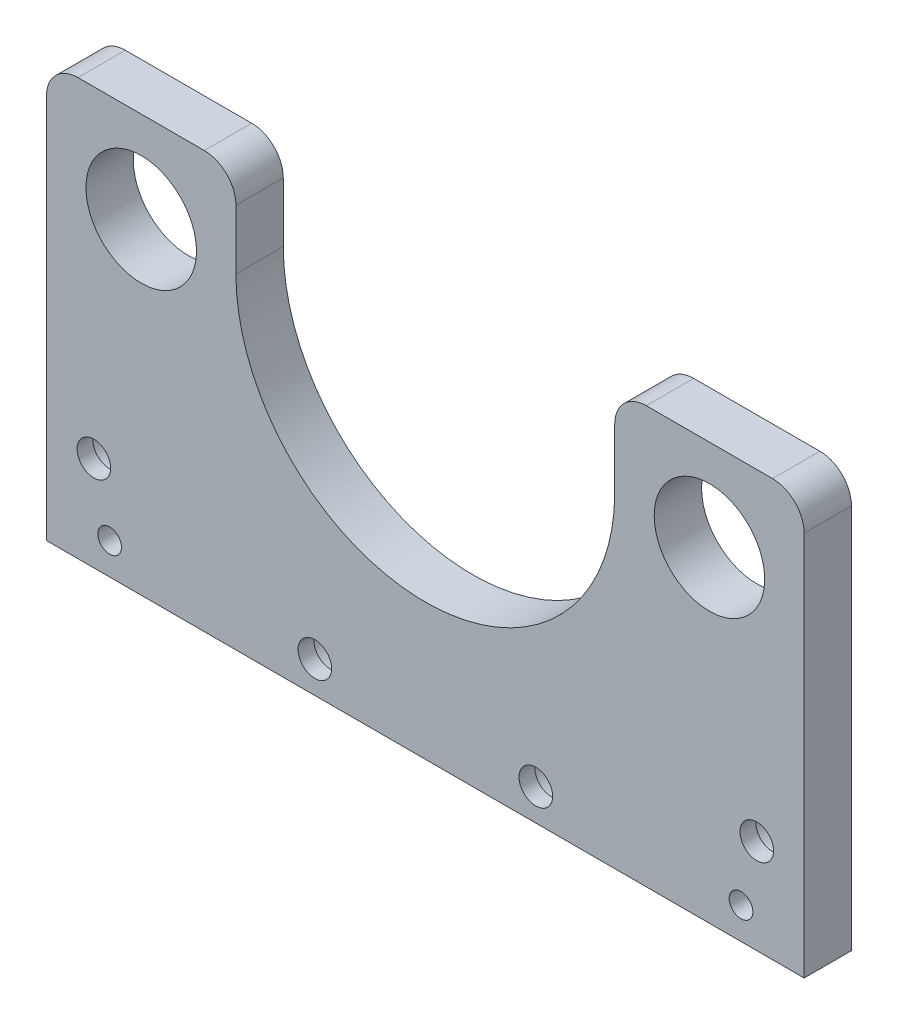
from build123d import *

# Parameters (mm, degrees)
SKETCH1_R                                   = 11.1125
BASE_DEPTH                                  = 4.7625
F_1_4_CAP_SCREW_CARRIAGE_MOUNTS_D           = 6.7564
F_1_4_CAP_SCREW_CARRIAGE_MOUNTS_CBORE_D     = 11.1125
F_1_4_CAP_SCREW_CARRIAGE_MOUNTS_CBORE_DEPTH = 6.35
SKETCH9_R                                   = 2.38125
ALIGNMENT_PIN_HOLES_DEPTH                   = 6.35


with BuildPart() as part:
    # Sketch1 → Base (new, symmetric)
    with BuildSketch(Plane.XY):
        with BuildLine():
            Line((76.2, 11.98626), (76.2, -65.48374))
            Line((76.2, -65.48374), (-76.2, -65.48374))
            Line((-76.2, -65.48374), (-76.2, 11.98626))
            ThreePointArc((-76.2, 11.98626), (-74.340128061, 16.476388061), (-69.85, 18.33626))
            Line((-69.85, 18.33626), (-44.45, 18.33626))
            ThreePointArc((-44.45, 18.33626), (-39.959871939, 16.476388061), (-38.1, 11.98626))
            Line((-38.1, 11.98626), (-38.1, 0))
            ThreePointArc((-38.1, 0), (0, -38.1), (38.1, 0))
            Line((38.1, 0), (38.1, 11.98626))
            ThreePointArc((38.1, 11.98626), (39.959871939, 16.476388061), (44.45, 18.33626))
            Line((44.45, 18.33626), (69.85, 18.33626))
            ThreePointArc((69.85, 18.33626), (74.340128061, 16.476388061), (76.2, 11.98626))
        make_face()
        with Locations((-57.15, 0)):
            Circle(SKETCH1_R, mode=Mode.SUBTRACT)
        with Locations((57.15, 0)):
            Circle(SKETCH1_R, mode=Mode.SUBTRACT)
    extrude(amount=BASE_DEPTH, both=True)

    # 1/4 Cap screw carriage mounts (through all)
    with Locations(Plane(origin=(-61.987391614, 5.409091563, -4.7625), x_dir=(1, 0, 0), z_dir=(0, 0, -1))):
        with Locations((-4.687608386, 51.842831563), (39.762391614, 64.542831563), (128.662391614, 51.842831563), (84.212391614, 64.542831563)):
            CounterBoreHole(F_1_4_CAP_SCREW_CARRIAGE_MOUNTS_D / 2, F_1_4_CAP_SCREW_CARRIAGE_MOUNTS_CBORE_D / 2, F_1_4_CAP_SCREW_CARRIAGE_MOUNTS_CBORE_DEPTH)

    # Sketch9 → Alignment_pin_holes (cut)
    with BuildSketch(Plane(origin=(0, 0, 4.7625), x_dir=(-1, 0, 0), z_dir=(0, 0, -1))):
        with Locations((63.5, -59.13374)):
            Circle(SKETCH9_R)
        with Locations((-63.5, -59.13374)):
            Circle(SKETCH9_R)
    extrude(amount=ALIGNMENT_PIN_HOLES_DEPTH, mode=Mode.SUBTRACT)


solid = part.part
